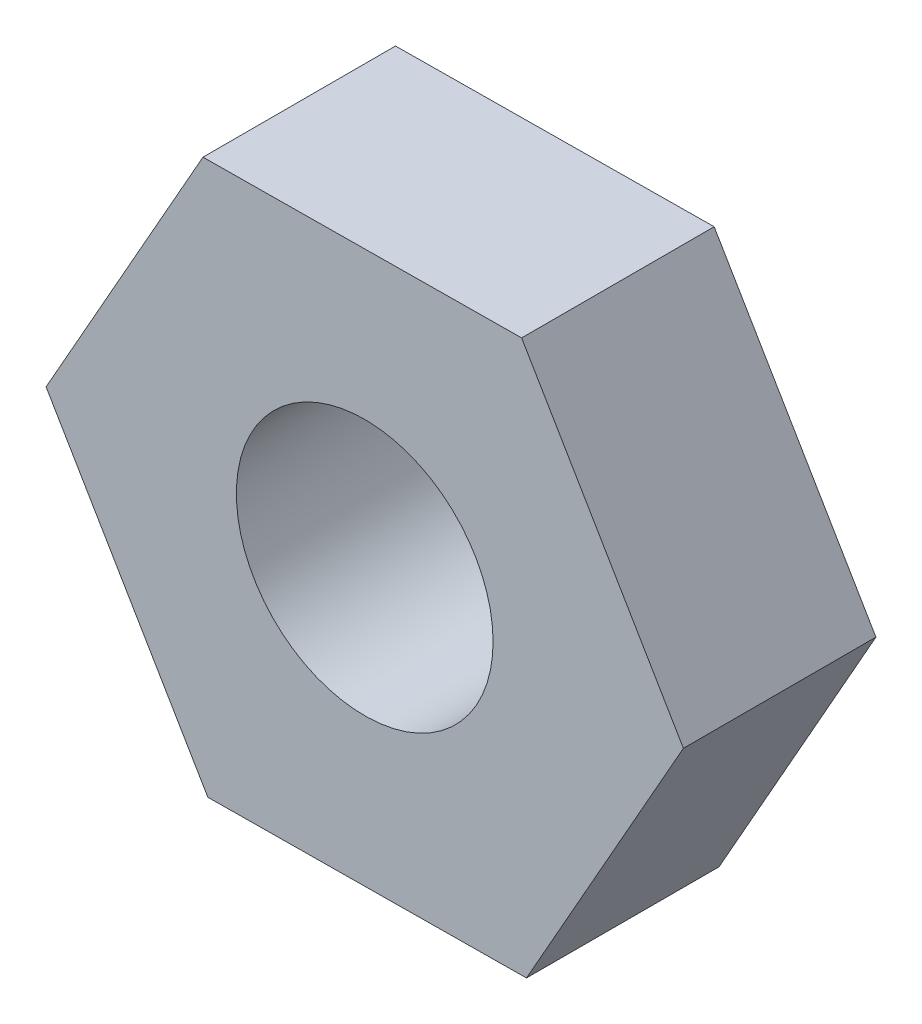
from build123d import *

# Parameters (mm, degrees)
SKETCH_1_R      = 1
EXTRUDE_1_DEPTH = 1.5


with BuildPart() as part:
    # 草图1 → 凸台-拉伸1 (new body)
    with BuildSketch(Plane.XY):
        Polygon((1.260180266, -2.138990189), (2.482509975, 0.02185303), (1.222329709, 2.160843219), (-1.260180266, 2.138990189), (-2.482509975, -0.02185303), (-1.222329709, -2.160843219), align=None)
        Circle(SKETCH_1_R, mode=Mode.SUBTRACT)
    extrude(amount=EXTRUDE_1_DEPTH)


solid = part.part
